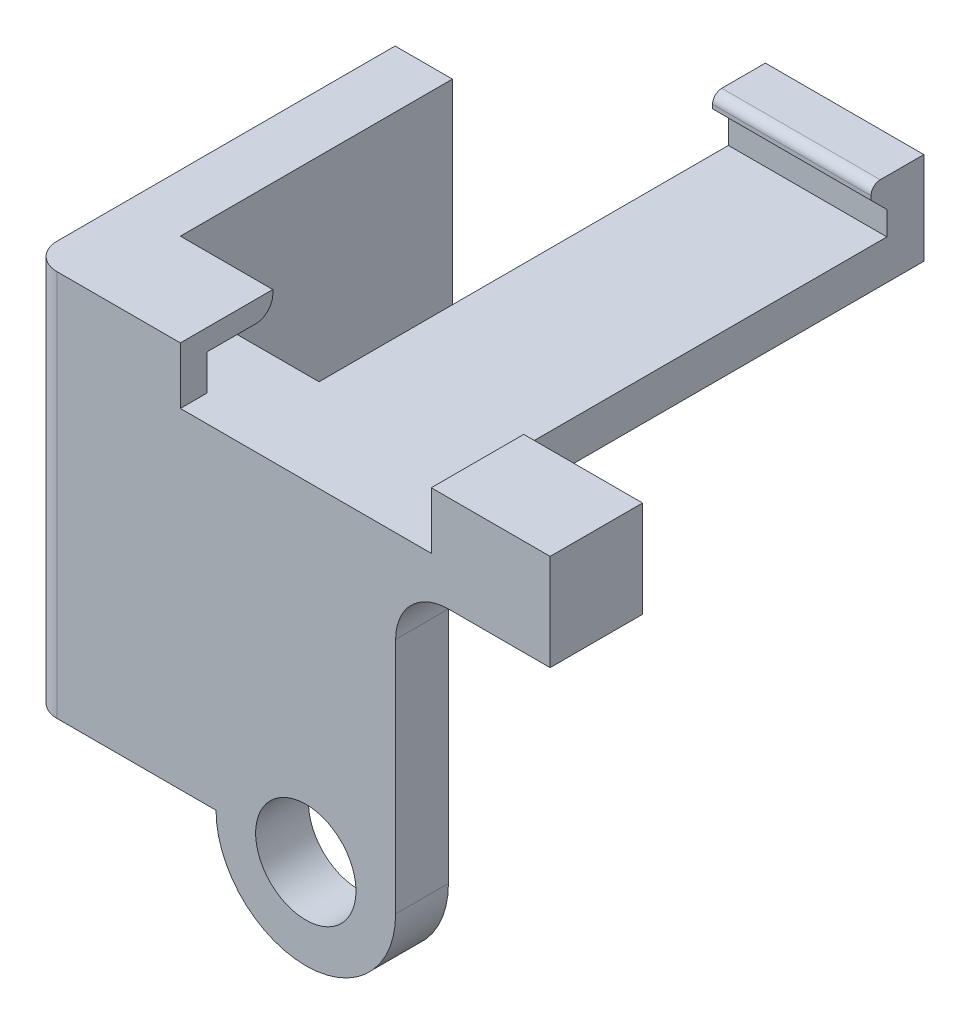
from build123d import *
from OCP.BRepFilletAPI import BRepFilletAPI_MakeFillet

# Parameters (mm, degrees)
BOSS_EXTRUDE1_DEPTH      = 6
BOSS_EXTRUDE2_DEPTH      = 2.15
BOSS_EXTRUDE2_DEPTH_BACK = 1.5
SKETCH3_W                = 18.5
SKETCH3_H                = 3.5
SKETCH4_W                = 15.5
SKETCH4_H                = 1.35
CUT_EXTRUDE1_DEPTH       = 2.5
CUT_EXTRUDE2_REACH       = 24.817
SKETCH5_W                = 9.5
SKETCH5_H                = 5
FILLET1_R                = 0.65
SKETCH6_R                = 1.9
BOSS_EXTRUDE3_DEPTH      = 2
BOSS_EXTRUDE4_DEPTH      = 1.17
BOSS_EXTRUDE4_DEPTH_BACK = 1
SKETCH7_R                = 1.9
FILLET2_R1               = 1
FILLET2_R2               = 2


with BuildPart() as part:
    # Sketch2 → Boss-Extrude1 (new body)
    with BuildSketch(Plane(origin=(0, 0, 0), x_dir=(0, 0, -1), z_dir=(1, 0, 0))):
        with BuildLine():
            Line((0, 0), (18.9, 0))
            Line((18.9, 0), (18.9, 3.5))
            Line((18.9, 3.5), (17.25, 3.5))
            ThreePointArc((17.25, 3.5), (17.002512627, 3.397487373), (16.9, 3.15))
            Line((16.9, 3.15), (16.9, 3))
            Line((16.9, 3), (17.5, 2.4))
            Line((17.5, 2.4), (17.5, 1.5))
            Line((17.5, 1.5), (0, 1.5))
            Line((0, 1.5), (0, 0))
        make_face()
    extrude(amount=BOSS_EXTRUDE1_DEPTH)

    # Sketch3 → Boss-Extrude2 (add, two sides: drawn at the far end of the back side and taken through both)
    with BuildSketch(Plane(origin=(0, 1.5, 0), x_dir=(1, 0, 0), z_dir=(0, 1, 0)).offset(-BOSS_EXTRUDE2_DEPTH_BACK)):
        with Locations((3, 0.25)):
            Rectangle(SKETCH3_W, SKETCH3_H)
    extrude(amount=BOSS_EXTRUDE2_DEPTH + BOSS_EXTRUDE2_DEPTH_BACK)

    # Sketch4 → Cut-Extrude1 (cut)
    with BuildSketch(Plane(origin=(0, 0, -2), x_dir=(-1, 0, 0), z_dir=(0, 0, -1))):
        with Locations((-3, 2.175)):
            Rectangle(SKETCH4_W, SKETCH4_H)
    extrude(amount=-CUT_EXTRUDE1_DEPTH, mode=Mode.SUBTRACT)

    # Cut-Extrude2: up to this face of the body (flat: up to its plane)
    cut_extrude2_end = Plane(part.part.faces().sort_by_distance((3, 1.5, -7.102941176))[0])
    # Sketch5 → Cut-Extrude2 (cut, up to the picked face)
    with BuildSketch(Plane(origin=(0, 3.65, 0), x_dir=(1, 0, 0), z_dir=(0, 1, 0)), mode=Mode.PRIVATE) as cut_extrude2_sk1:
        with Locations((3, 1)):
            Rectangle(SKETCH5_W, SKETCH5_H)
    cut_extrude2_tool1 = split(extrude(cut_extrude2_sk1.sketch, amount=-CUT_EXTRUDE2_REACH, mode=Mode.PRIVATE), bisect_by=cut_extrude2_end, keep=Keep.BOTH, mode=Mode.PRIVATE)
    add(cut_extrude2_tool1.solids().sort_by(Axis((3, 3.65, -1), (0, -1, 0)))[0], mode=Mode.SUBTRACT)

    # Fillet1
    fillet1_edges = [part.edges().sort_by_distance(p)[0] for p in [
        (-3.25, 2.85, -2),
        (9.25, 2.85, -2),
    ]]
    fillet(fillet1_edges, radius=FILLET1_R)

    # Sketch6 → Boss-Extrude3 (add)
    with BuildSketch(Plane.XY.offset(1.5)):
        with BuildLine():
            Line((-5.4, 0), (6.4, 0))
            Line((6.4, 0), (6.4, -11))
            ThreePointArc((6.4, -11), (3, -14.4), (-0.4, -11))
            Line((-0.4, -11), (-5.4, -11))
            Line((-5.4, -11), (-5.4, 0))
        make_face()
        with Locations((3, -11)):
            Circle(SKETCH6_R, mode=Mode.SUBTRACT)
    extrude(amount=-BOSS_EXTRUDE3_DEPTH)

    # Sketch7 → Boss-Extrude4 (add, two sides: drawn at the far end of the back side and taken through both)
    with BuildSketch(Plane.ZY.offset(6.25).offset(-BOSS_EXTRUDE4_DEPTH_BACK)):
        with BuildLine():
            Line((1.5, 3.65), (-12.3, 3.65))
            Line((-12.3, 3.65), (-12.3, -11))
            ThreePointArc((-12.3, -11), (-8.9, -14.4), (-5.5, -11))
            Line((-5.5, -11), (1.5, -11))
            Line((1.5, -11), (1.5, 3.65))
        make_face()
        with Locations(Location((-8.9, -11, 0), (0, 0, 180))):
            Circle(SKETCH7_R, mode=Mode.SUBTRACT)
    extrude(amount=BOSS_EXTRUDE4_DEPTH + BOSS_EXTRUDE4_DEPTH_BACK)

    # Fillet2: one fillet with a radius per group of edges: ONE call of the kernel's fillet builder (fillet() takes one radius for all edges)
    fillet2_edges_1 = [part.edges().sort_by_distance(p)[0] for p in [
        (-7.42, -3.675, 1.5),
    ]]
    fillet2_edges_2 = [part.edges().sort_by_distance(p)[0] for p in [
        (6.4, 0, 0.5),
    ]]
    fillet2 = BRepFilletAPI_MakeFillet(part.part.solid().wrapped)
    for e in fillet2_edges_1:
        fillet2.Add(FILLET2_R1, e.wrapped)
    for e in fillet2_edges_2:
        fillet2.Add(FILLET2_R2, e.wrapped)
    add(Compound.cast(fillet2.Shape()), mode=Mode.REPLACE)


solid = part.part
